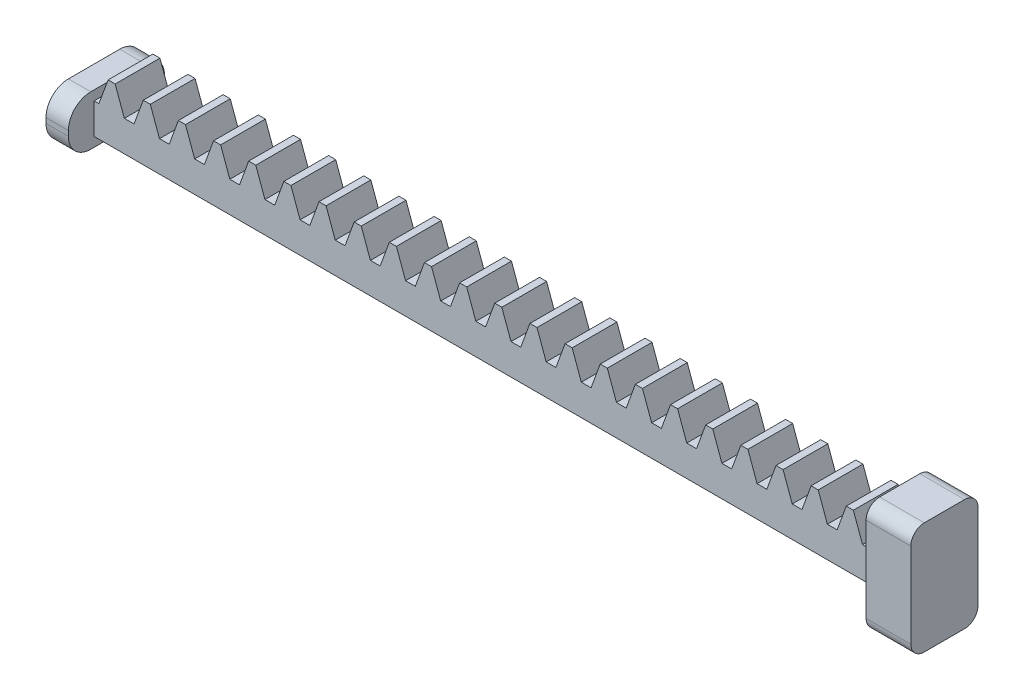
from build123d import *

# Parameters (mm, degrees)
BLANKSKE_W         = 175
BLANKSKE_H         = 12.5
BLANK_DEPTH        = 10
TOOTHCUTSIM_DEPTH  = 176.730617708
TEETHCUTS_COUNT    = 23
TEETHCUTS_PITCH    = 7.853981625
BOSS_EXTRU_1_DEPTH = 5
BOSS_EXTRU_2_DEPTH = 10


with BuildPart() as part:
    # BlankSke → Blank (new body)
    with BuildSketch(Plane.XY):
        with Locations((87.5, 6.25)):
            Rectangle(BLANKSKE_W, BLANKSKE_H)
    extrude(amount=-BLANK_DEPTH)

    # TooCutSkeSim → ToothCutSim (cut, through all)
    with BuildSketch(Plane.XY):
        Polygon((1.087088424, 6.875), (-1.087088424, 6.875), (-3.143665836, 12.5254), (3.143665836, 12.5254), align=None)
    toothcutsim = extrude(amount=-TOOTHCUTSIM_DEPTH, mode=Mode.SUBTRACT)

    # TeethCuts: ToothCutSim ×23
    with Locations(*[(i * TEETHCUTS_PITCH, 0, 0) for i in range(1, TEETHCUTS_COUNT)]):
        add(toothcutsim, mode=Mode.SUBTRACT)

    # Esquisse1 → Boss.-Extru.1 (add)
    with BuildSketch(Plane.ZY):
        with BuildLine():
            Line((-10.736438124, 9.003272752), (0.736438124, 9.003272752))
            ThreePointArc((0.736438124, 9.003272752), (4.27197203, 7.538806658), (5.736438124, 4.003272752))
            Line((5.736438124, 4.003272752), (5.736438124, 2.871727248))
            ThreePointArc((5.736438124, 2.871727248), (4.27197203, -0.663806658), (0.736438124, -2.128272752))
            Line((0.736438124, -2.128272752), (-10.736438124, -2.128272752))
            ThreePointArc((-10.736438124, -2.128272752), (-14.27197203, -0.663806658), (-15.736438124, 2.871727248))
            Line((-15.736438124, 2.871727248), (-15.736438124, 4.003272752))
            ThreePointArc((-15.736438124, 4.003272752), (-14.27197203, 7.538806658), (-10.736438124, 9.003272752))
        make_face()
    extrude(amount=BOSS_EXTRU_1_DEPTH)

    # Esquisse2 → Boss.-Extru.2 (add)
    with BuildSketch(Plane(origin=(175, 0, 0), x_dir=(0, 0, -1), z_dir=(1, 0, 0))):
        with BuildLine():
            Line((9.5, 17.483389911), (0.5, 17.483389911))
            ThreePointArc((0.5, 17.483389911), (-1.621320344, 16.604710254), (-2.5, 14.483389911))
            Line((-2.5, 14.483389911), (-2.5, -4.516610089))
            ThreePointArc((-2.5, -4.516610089), (-1.621320344, -6.637930433), (0.5, -7.516610089))
            Line((0.5, -7.516610089), (9.5, -7.516610089))
            ThreePointArc((9.5, -7.516610089), (11.621320344, -6.637930433), (12.5, -4.516610089))
            Line((12.5, -4.516610089), (12.5, 14.483389911))
            ThreePointArc((12.5, 14.483389911), (11.621320344, 16.604710254), (9.5, 17.483389911))
        make_face()
    extrude(amount=BOSS_EXTRU_2_DEPTH)


solid = part.part
